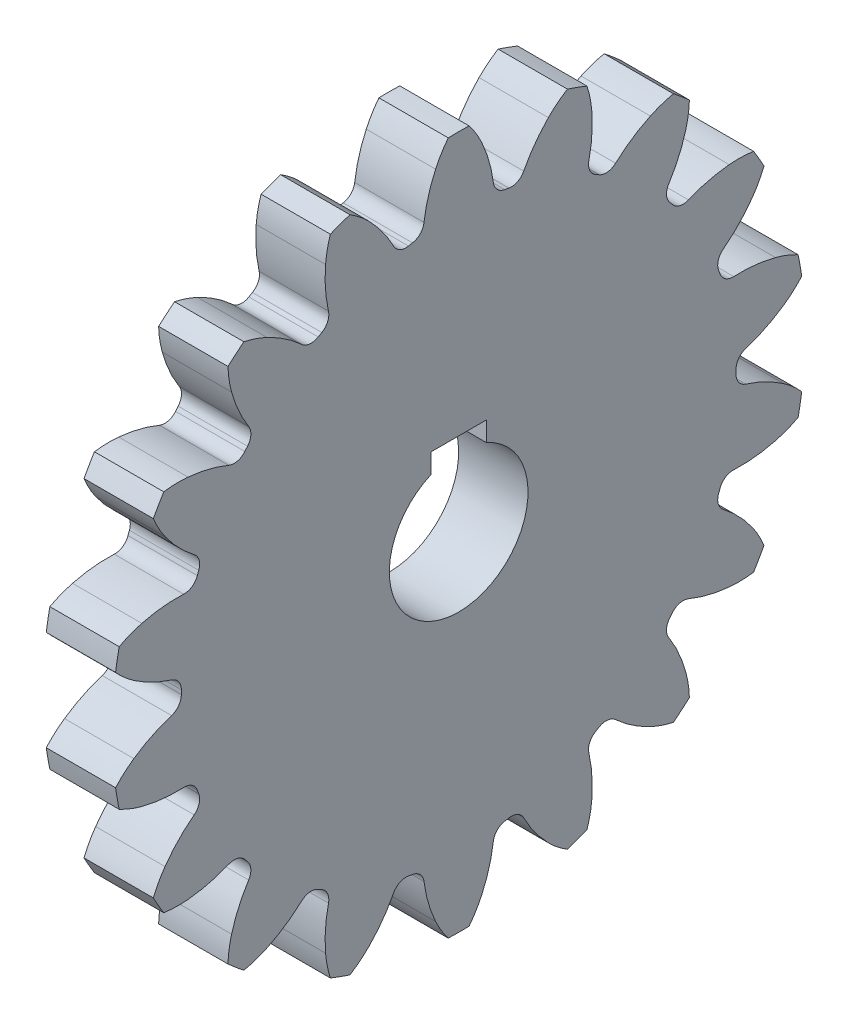
from build123d import *

# Parameters (mm, degrees)
SKETCH1_R           = 40
BOSS_EXTRUDE1_DEPTH = 10
BOSS_EXTRUDE2_DEPTH = 10
CIRPATTERN1_COUNT   = 18
CUT_EXTRUDE1_DEPTH  = 72.050273979


with BuildPart() as part:
    # Sketch1 → Boss-Extrude1 (new body)
    with BuildSketch(Plane(origin=(0, 0, 0), x_dir=(0, 0, -1), z_dir=(1, 0, 0))):
        Circle(SKETCH1_R)
    extrude(amount=BOSS_EXTRUDE1_DEPTH)

    # Sketch2 → Boss-Extrude2 (add)
    with BuildSketch(Plane(origin=(0, 0, 0), x_dir=(0, 0, -1), z_dir=(1, 0, 0))):
        with BuildLine():
            Line((-6.651244388, 39.443135627), (0, 0))
            Line((0, 0), (6.651244388, 39.443135627))
            ThreePointArc((6.651244388, 39.443135627), (5.541789031, 40.029440573), (5, 41.161301574))
            ThreePointArc((5, 41.161301574), (4.386777428, 44.135501707), (3.330330494, 46.982575332))
            ThreePointArc((3.330330494, 46.982575332), (2.503066904, 48.533755802), (1.5, 49.977494935))
            ThreePointArc((1.5, 49.977494935), (0, 50), (-1.5, 49.977494935))
            ThreePointArc((-1.5, 49.977494935), (-2.503066904, 48.533755802), (-3.330330494, 46.982575332))
            ThreePointArc((-3.330330494, 46.982575332), (-4.386777428, 44.135501707), (-5, 41.161301574))
            ThreePointArc((-5, 41.161301574), (-5.541789031, 40.029440573), (-6.651244388, 39.443135627))
        make_face()
    boss_extrude2 = extrude(amount=BOSS_EXTRUDE2_DEPTH)

    # CirPattern1: Boss-Extrude2 ×18 about axis
    cirpattern1_axis = Axis((-0.5, 0, 0), (1, 0, 0))
    for i in range(1, CIRPATTERN1_COUNT):
        add(boss_extrude2.rotate(cirpattern1_axis, i * 360 / CIRPATTERN1_COUNT))

    # Sketch3 → Cut-Extrude1 (cut, through all)
    with BuildSketch(Plane(origin=(0, 0, 0), x_dir=(0, 0, -1), z_dir=(1, 0, 0))):
        with BuildLine():
            Line((-4, 9.16515139), (-4, 12))
            Line((-4, 12), (4, 12))
            Line((4, 12), (4, 9.16515139))
            ThreePointArc((4, 9.16515139), (0, -10), (-4, 9.16515139))
        make_face()
    extrude(amount=CUT_EXTRUDE1_DEPTH, mode=Mode.SUBTRACT)


solid = part.part
